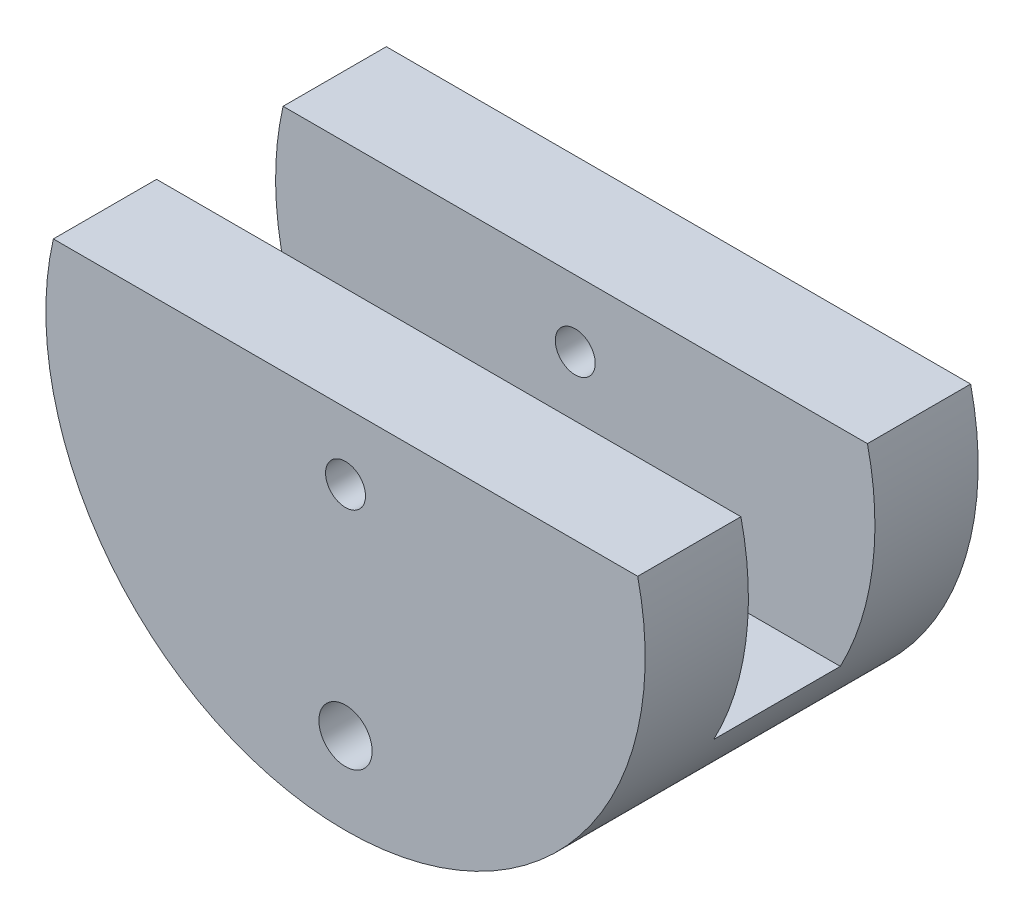
from build123d import *

# Parameters (mm, degrees)
SKETCH_1_R          = 4
SKETCH_1_R_2        = 3
EXTRUDE_1_DEPTH     = 25
SKETCH_2_W          = 106.280509252
SKETCH_2_H          = 41.998888678
CUT_EXTRUDE_1_DEPTH = 9.5
CUT_EXTRUDE_2_DEPTH = 3


with BuildPart() as part:
    # 草图1 → 凸台-拉伸1 (new, symmetric)
    with BuildSketch(Plane.XY):
        with BuildLine():
            Line((-43.874821937, 10), (43.874821937, 10))
            ThreePointArc((43.874821937, 10), (0, -45), (-43.874821937, 10))
        make_face()
        with Locations((0, -32.69)):
            Circle(SKETCH_1_R, mode=Mode.SUBTRACT)
        Circle(SKETCH_1_R_2, mode=Mode.SUBTRACT)
    extrude(amount=EXTRUDE_1_DEPTH, both=True)

    # 草图2 → 切除-拉伸1 (cut, symmetric)
    with BuildSketch(Plane.XY):
        Rectangle(SKETCH_2_W, SKETCH_2_H)
    extrude(amount=CUT_EXTRUDE_1_DEPTH, both=True, mode=Mode.SUBTRACT)

    # 草图3 → 切除-拉伸2 (cut, symmetric)
    with BuildSketch(Plane.XY):
        with BuildLine():
            Line((-8.4, -32.69), (-8.4, -18.964049075))
            Line((-8.4, -18.964049075), (8.4, -18.964049075))
            Line((8.4, -18.964049075), (8.4, -32.69))
            ThreePointArc((8.4, -32.69), (0, -41.09), (-8.4, -32.69))
        make_face()
    extrude(amount=CUT_EXTRUDE_2_DEPTH, both=True, mode=Mode.SUBTRACT)


solid = part.part
